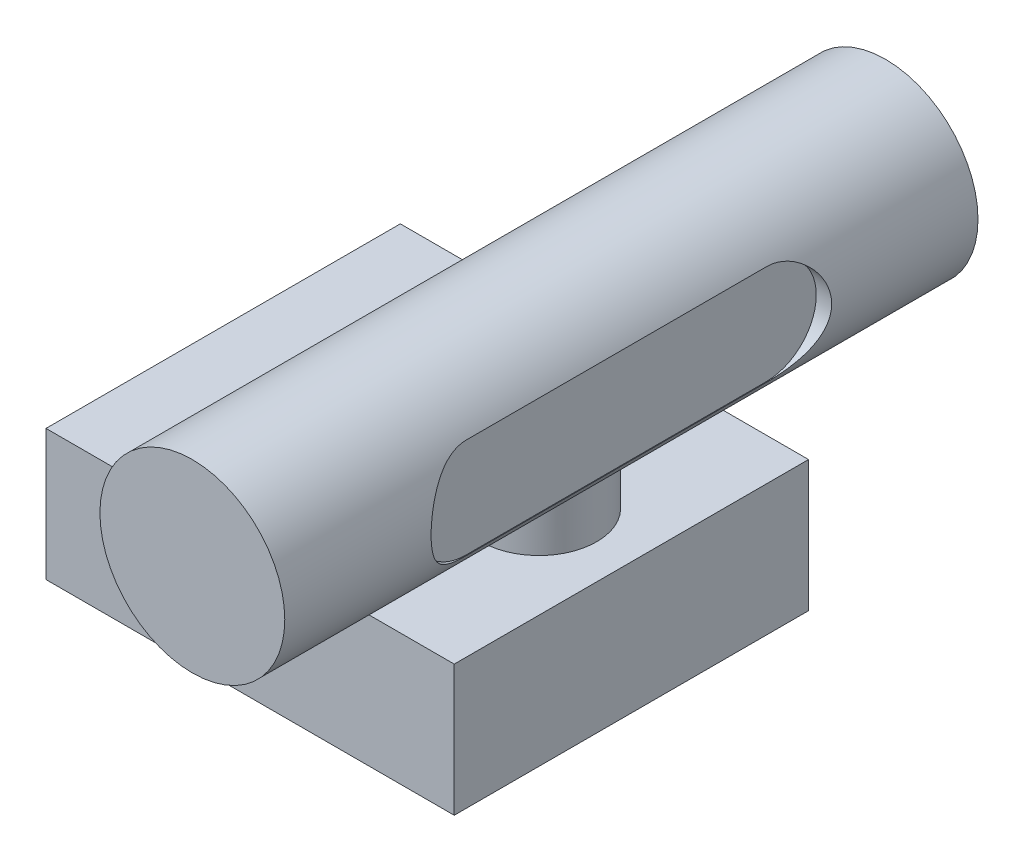
from build123d import *

# Parameters (mm, degrees)
SKETCH1_R           = 12
BOSS_EXTRUDE1_DEPTH = 45
SKETCH2_R           = 7.5
BOSS_EXTRUDE2_DEPTH = 16
SKETCH3_W           = 53
SKETCH3_H           = 46
BOSS_EXTRUDE3_DEPTH = 17
CUT_EXTRUDE1_DEPTH  = 2


with BuildPart() as part:
    # Sketch1 → Boss-Extrude1 (new, symmetric)
    with BuildSketch(Plane.XY):
        with Locations(Location((0, 0, 0), (0, 0, 180))):
            Circle(SKETCH1_R)
    extrude(amount=BOSS_EXTRUDE1_DEPTH, both=True)

    # Sketch2 → Boss-Extrude2 (add)
    with BuildSketch(Plane(origin=(0, 0, 0), x_dir=(1, 0, 0), z_dir=(0, 1, 0))):
        with Locations(Location((0, 0, 0), (0, 0, 270))):
            Circle(SKETCH2_R)
    extrude(amount=-BOSS_EXTRUDE2_DEPTH)

    # Sketch3 → Boss-Extrude3 (add)
    with BuildSketch(Plane.XZ.offset(16)):
        with Locations((-14.5, 0)):
            Rectangle(SKETCH3_W, SKETCH3_H)
    extrude(amount=BOSS_EXTRUDE3_DEPTH)

    # Sketch4 → Cut-Extrude1 (cut)
    with BuildSketch(Plane(origin=(12, 0, 0), x_dir=(0, 0, -1), z_dir=(1, 0, 0))):
        with BuildLine():
            Line((-19.5, 6.5), (19.5, 6.5))
            ThreePointArc((19.5, 6.5), (26, 0), (19.5, -6.5))
            Line((19.5, -6.5), (-19.5, -6.5))
            ThreePointArc((-19.5, -6.5), (-26, 0), (-19.5, 6.5))
        make_face()
    extrude(amount=-CUT_EXTRUDE1_DEPTH, mode=Mode.SUBTRACT)


solid = part.part
